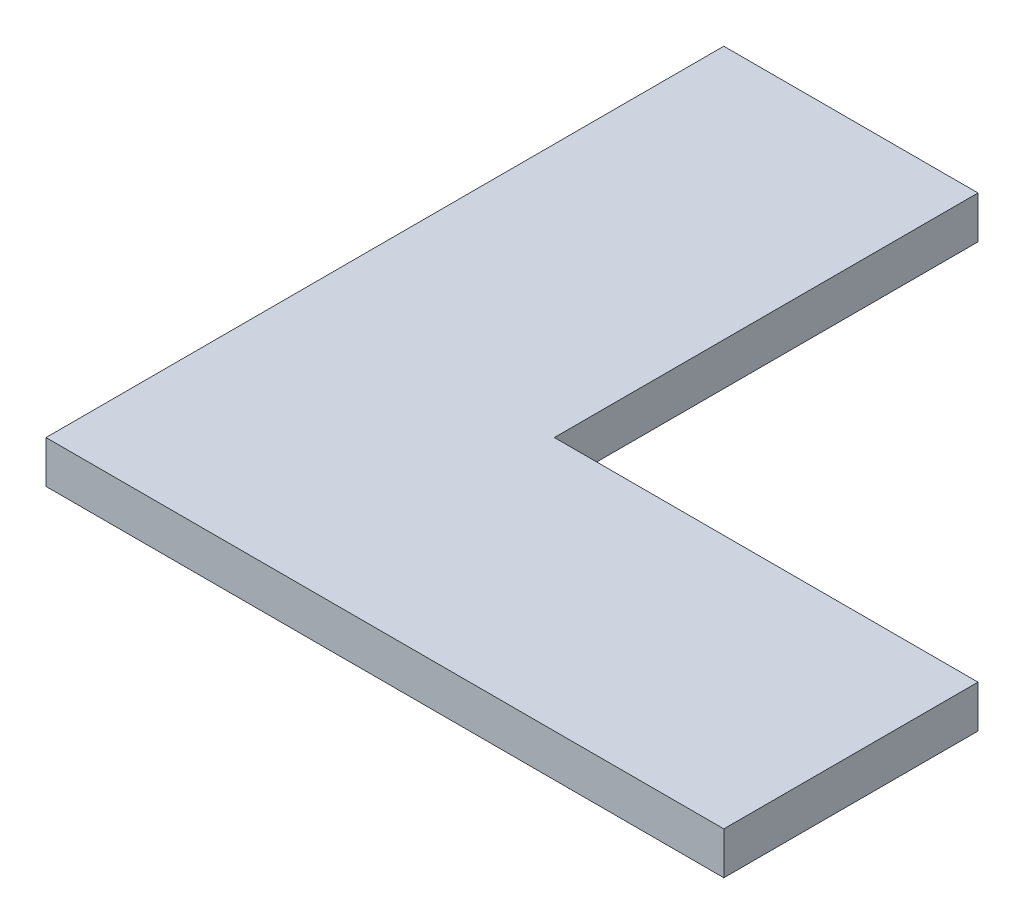
from build123d import *

# Parameters (mm, degrees)
BOSS_EXTRUDE1_DEPTH = 2.5


with BuildPart() as part:
    # Sketch1 → Boss-Extrude1 (new, symmetric)
    with BuildSketch(Plane(origin=(0, 0, 0), x_dir=(1, 0, 0), z_dir=(0, 1, 0))):
        Polygon((-40, 40), (-40, -40), (40, -40), (40, -10), (-10, -10), (-10, 40), align=None)
    extrude(amount=BOSS_EXTRUDE1_DEPTH, both=True)


solid = part.part
